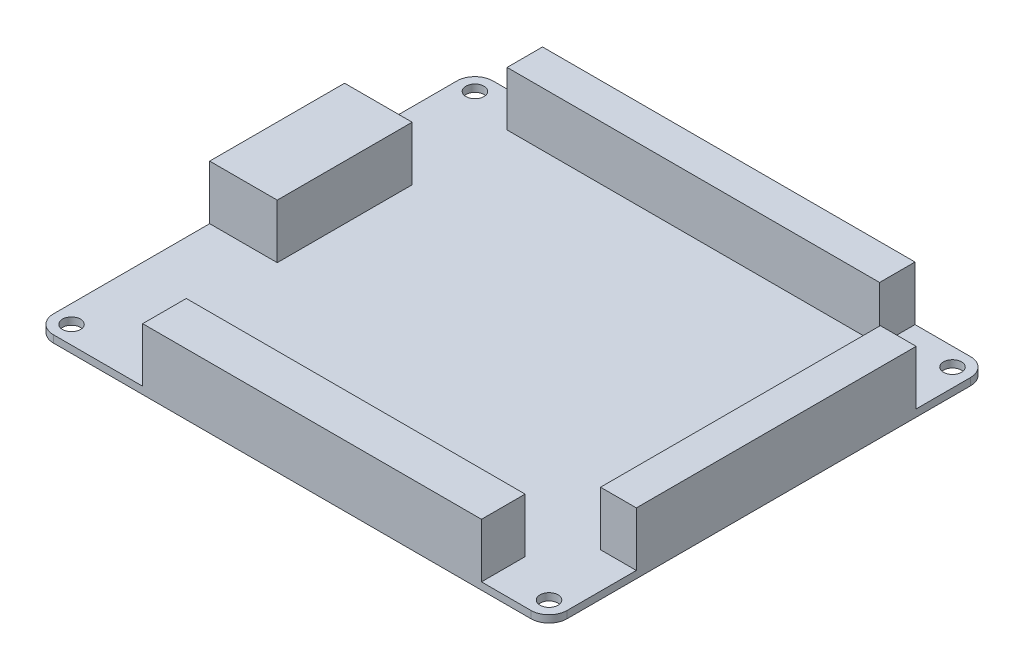
from build123d import *

# Parameters (mm, degrees)
SKETCH_1_R      = 1.5
EXTRUDE_1_DEPTH = 1.2
SKETCH_2_W      = 56.26507056
SKETCH_2_H      = 7.246466171
SKETCH_2_W_2    = 5.94694539
SKETCH_2_H_2    = 46.466862472
SKETCH_2_W_3    = 61.857792897
SKETCH_2_H_3    = 5.88577246
SKETCH_2_W_4    = 11.220508583
SKETCH_2_H_4    = 22.405589271
EXTRUDE_2_DEPTH = 9


with BuildPart() as part:
    # 草图1 → 凸台-拉伸1 (new body)
    with BuildSketch(Plane(origin=(0, 0, 0), x_dir=(1, 0, 0), z_dir=(0, 1, 0))):
        with BuildLine():
            Line((39.65, 36.5), (-39.65, 36.5))
            ThreePointArc((-39.65, 36.5), (-41.771320344, 35.621320344), (-42.65, 33.5))
            Line((-42.65, 33.5), (-42.65, -33.5))
            ThreePointArc((-42.65, -33.5), (-41.771320344, -35.621320344), (-39.65, -36.5))
            Line((-39.65, -36.5), (39.65, -36.5))
            ThreePointArc((39.65, -36.5), (41.771320344, -35.621320344), (42.65, -33.5))
            Line((42.65, -33.5), (42.65, 33.5))
            ThreePointArc((42.65, 33.5), (41.771320344, 35.621320344), (39.65, 36.5))
        make_face()
        with Locations(Location((39.65, -33.5, 0), (0, 0, 270))):
            Circle(SKETCH_1_R, mode=Mode.SUBTRACT)
        with Locations(Location((-39.65, -33.5, 0), (0, 0, 270))):
            Circle(SKETCH_1_R, mode=Mode.SUBTRACT)
        with Locations(Location((-39.65, 33.5, 0), (0, 0, 270))):
            Circle(SKETCH_1_R, mode=Mode.SUBTRACT)
        with Locations(Location((39.65, 33.5, 0), (0, 0, 270))):
            Circle(SKETCH_1_R, mode=Mode.SUBTRACT)
    extrude(amount=EXTRUDE_1_DEPTH)

    # 草图2 → 凸台-拉伸2 (add)
    with BuildSketch(Plane(origin=(0, 1.2, 0), x_dir=(1, 0, 0), z_dir=(0, 1, 0))):
        with Locations((3.299265125, -32.876766915)):
            Rectangle(SKETCH_2_W, SKETCH_2_H)
        with Locations((39.676527305, 1.231104757)):
            Rectangle(SKETCH_2_W_2, SKETCH_2_H_2)
        with Locations((-0.500594968, 33.55711377)):
            Rectangle(SKETCH_2_W_3, SKETCH_2_H_3)
        with Locations((-37.039745709, 3.646177151)):
            Rectangle(SKETCH_2_W_4, SKETCH_2_H_4)
    extrude(amount=EXTRUDE_2_DEPTH)


solid = part.part
